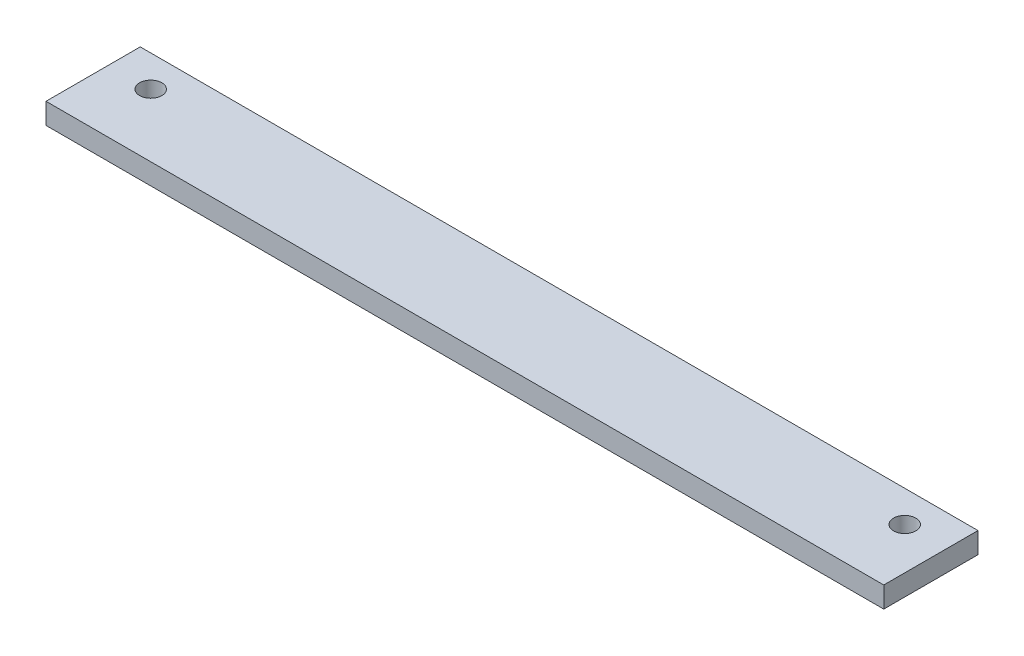
from build123d import *

# Parameters (mm, degrees)
SKETCH2_W                        = 254
SKETCH2_H                        = 28.575
BOSS_EXTRUDE1_DEPTH              = 6.35
F_17_64_0_26563_DIAMETER_HOLE1_D = 6.747002


with BuildPart() as part:
    # Sketch2 → Boss-Extrude1 (new body)
    with BuildSketch(Plane(origin=(0, 0, 0), x_dir=(1, 0, 0), z_dir=(0, 1, 0))):
        with Locations((127, 14.2875)):
            Rectangle(SKETCH2_W, SKETCH2_H)
    extrude(amount=BOSS_EXTRUDE1_DEPTH)

    # 17/64 (0.26563) Diameter Hole1 (through all)
    with Locations(Plane(origin=(0, 6.35, 0), x_dir=(1, 0, 0), z_dir=(0, 1, 0))):
        with Locations((12.7, 19.05), (241.3, 19.05)):
            Hole(F_17_64_0_26563_DIAMETER_HOLE1_D / 2)


solid = part.part
